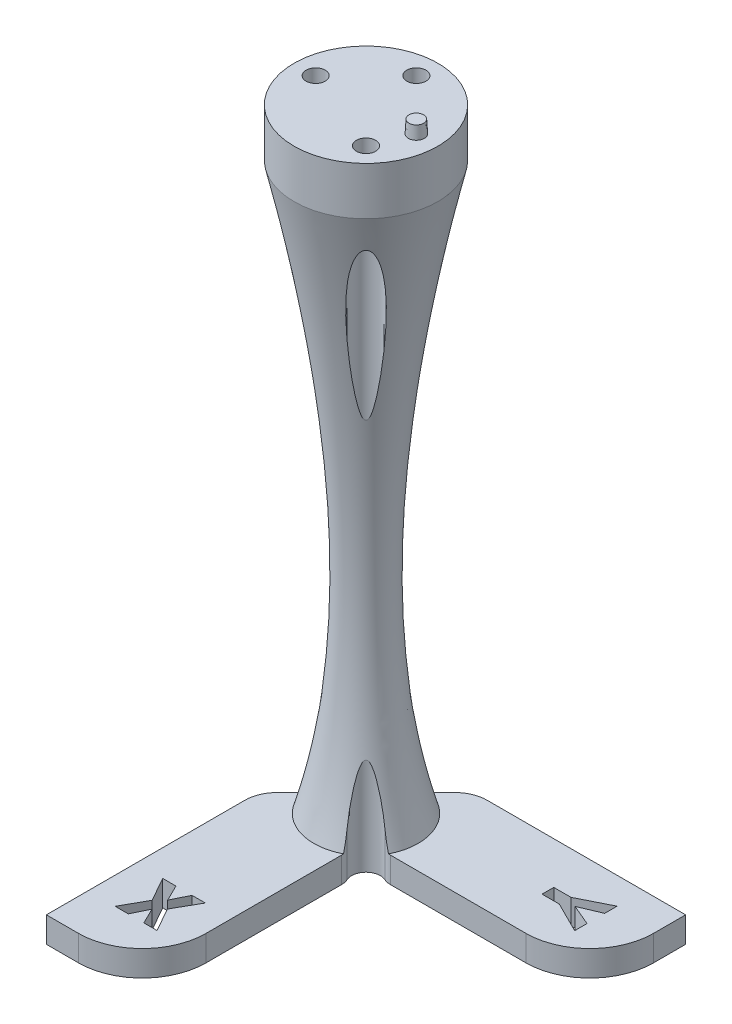
from build123d import *

# Parameters (mm, degrees)
SKETCH_1_R          = 22.5
EXTRUDE_1_DEPTH     = 200
EXTRUDE_2_DEPTH     = 8
SKETCH_3_R          = 2.5
EXTRUDE_3_DEPTH     = 4
EXTRUDE_3_TAPER     = 3
SKETCH_4_R          = 3
CUT_EXTRUDE_1_DEPTH = 229.062491436
SKETCH_5_R          = 4.5
CUT_EXTRUDE_2_DEPTH = 220.34561769
CUT_EXTRUDE_4_DEPTH = 210.889256599


with BuildPart() as part:
    # Эскиз1 → Бобышка-Вытянуть1 (new body)
    with BuildSketch(Plane(origin=(0, 0, 0), x_dir=(1, 0, 0), z_dir=(0, 1, 0))):
        with Locations(Location((0, 0, 0), (0, 0, 270))):
            Circle(SKETCH_1_R)
    extrude(amount=-EXTRUDE_1_DEPTH)

    # Эскиз2 → Бобышка-Вытянуть2 (add)
    with BuildSketch(Plane.XZ.offset(200)):
        with BuildLine():
            Line((-22.5, -22.5), (-22.5, 77.5))
            Line((-22.5, 77.5), (-12.5, 77.5))
            ThreePointArc((-12.5, 77.5), (1.642135624, 71.642135624), (7.5, 57.5))
            Line((7.5, 57.5), (7.5, 27.5))
            ThreePointArc((7.5, 27.5), (13.357864376, 13.357864376), (27.5, 7.5))
            Line((27.5, 7.5), (57.5, 7.5))
            ThreePointArc((57.5, 7.5), (71.642135624, 1.642135624), (77.5, -12.5))
            Line((77.5, -12.5), (77.5, -22.5))
            Line((77.5, -22.5), (-22.5, -22.5))
        make_face()
        Polygon((-7.512175325, 59.448504379), (-5.067978896, 64.434299833), (-0.946631494, 64.434299833), (-5.128855519, 56.998220288), (-0.83400974, 49.434299833), (-4.994926948, 49.434299833), (-7.512175325, 54.514454054), (-10.029423701, 49.434299833), (-14.178165584, 49.434299833), (-9.89549513, 56.998220288), (-14.065543831, 64.434299833), (-9.956371753, 64.434299833), align=None, mode=Mode.SUBTRACT)
        Polygon((57.923544963, -7.481737013), (64.434299833, -10.236404221), (64.434299833, -14.129464286), (54.821881002, -9.311079545), (49.434299833, -9.311079545), (49.434299833, -5.652394481), (54.821881002, -5.652394481), (64.434299833, -0.846185065), (64.434299833, -4.717938312), align=None, mode=Mode.SUBTRACT)
    extrude(amount=-EXTRUDE_2_DEPTH)

    # Эскиз3 → Бобышка-Вытянуть3 (add)
    with BuildSketch(Plane(origin=(0, 0, 0), x_dir=(1, 0, 0), z_dir=(0, 1, 0))):
        with Locations((15.75, 0)):
            Circle(SKETCH_3_R)
    extrude(amount=EXTRUDE_3_DEPTH, taper=EXTRUDE_3_TAPER)

    # Эскиз4 → Вырез-Вытянуть1 (cut, through all)
    with BuildSketch(Plane(origin=(0, 0, 0), x_dir=(1, 0, 0), z_dir=(0, 1, 0))):
        with Locations(Location((-15.75, 0, 0), (0, 0, 270))):
            Circle(SKETCH_4_R)
        with Locations(Location((0, 15.75, 0), (0, 0, 270))):
            Circle(SKETCH_4_R)
        with Locations(Location((11.136931804, -11.136931804, 0), (0, 0, 270))):
            Circle(SKETCH_4_R)
    extrude(amount=-CUT_EXTRUDE_1_DEPTH, mode=Mode.SUBTRACT)

    # Эскиз5 → Вырез-Вытянуть2 (cut, through all)
    with BuildSketch(Plane(origin=(0, -10, 0), x_dir=(1, 0, 0), z_dir=(0, 1, 0))):
        with Locations(Location((-15.75, 0, 0), (0, 0, 270))):
            Circle(SKETCH_5_R)
        with Locations(Location((11.136931804, -11.136931804, 0), (0, 0, 270))):
            Circle(SKETCH_5_R)
        with Locations(Location((0, 15.75, 0), (0, 0, 270))):
            Circle(SKETCH_5_R)
    extrude(amount=-CUT_EXTRUDE_2_DEPTH, mode=Mode.SUBTRACT)

    # Эскиз8 → Вырез-Повернуть1 (revolve, cut)
    with BuildSketch(Plane(origin=(0, 0, 0), x_dir=(0, 0, -1), z_dir=(1, 0, 0))):
        with BuildLine():
            Line((-22.9570782, -192), (-16.320910693, -192))
            add(Edge.make_bspline(
                [(-22.5, -15), (3.01114851, -126.383461967), (-16.320910693, -192)],
                knots=[0, 0, 0, 1, 1, 1], degree=2))
            Line((-22.5, -15), (-22.9570782, -192))
        make_face()
    revolve(axis=Axis((0, 0, 0), (0, -1, 0)), mode=Mode.SUBTRACT)

    # Эскиз9 → Вырез-Вытянуть4 (cut, through all)
    with BuildSketch(Plane(origin=(0, -175, 0), x_dir=(-1, 0, 0), z_dir=(0, -1, 0))):
        with BuildLine():
            Line((5.663590108, 16.913590108), (9.785533906, 21.035533906))
            ThreePointArc((9.785533906, 21.035533906), (11.40765065, 22.119397663), (13.321067812, 22.5))
            Line((13.321067812, 22.5), (-15.392135624, 22.5))
            ThreePointArc((-15.392135624, 22.5), (-11.5653013, 21.738795325), (-8.321067812, 19.571067812))
            Line((-8.321067812, 19.571067812), (-5.663590108, 16.913590108))
            ThreePointArc((-5.663590108, 16.913590108), (-4.857231171, 15.857565537), (-4.357479796, 14.626447675))
            ThreePointArc((-4.357479796, 14.626447675), (0, 11.25), (4.357479796, 14.626447675))
            ThreePointArc((4.357479796, 14.626447675), (4.857231171, 15.857565537), (5.663590108, 16.913590108))
        make_face()
        with BuildLine():
            Line((22.5, 13.321067812), (22.5, -15.392135624))
            ThreePointArc((22.5, -15.392135624), (21.738795325, -11.5653013), (19.571067812, -8.321067812))
            Line((19.571067812, -8.321067812), (16.913590108, -5.663590108))
            ThreePointArc((16.913590108, -5.663590108), (15.857565537, -4.857231171), (14.626447675, -4.357479796))
            ThreePointArc((14.626447675, -4.357479796), (11.25, 0), (14.626447675, 4.357479796))
            ThreePointArc((14.626447675, 4.357479796), (15.857565537, 4.857231171), (16.913590108, 5.663590108))
            Line((16.913590108, 5.663590108), (21.035533906, 9.785533906))
            ThreePointArc((21.035533906, 9.785533906), (22.119397663, 11.40765065), (22.5, 13.321067812))
        make_face()
        with BuildLine():
            Line((-7.5, -15.093370735), (-7.5, -57.5))
            Line((-7.5, -57.5), (-57.5, -7.5))
            Line((-57.5, -7.5), (-15.093370735, -7.5))
            ThreePointArc((-15.093370735, -7.5), (-14.027717861, -7.385118622), (-13.011034455, -7.045753581))
            ThreePointArc((-13.011034455, -7.045753581), (-7.954951288, -7.954951288), (-7.045753581, -13.011034455))
            ThreePointArc((-7.045753581, -13.011034455), (-7.385118622, -14.027717861), (-7.5, -15.093370735))
        make_face()
    extrude(amount=CUT_EXTRUDE_4_DEPTH, mode=Mode.SUBTRACT)


solid = part.part
